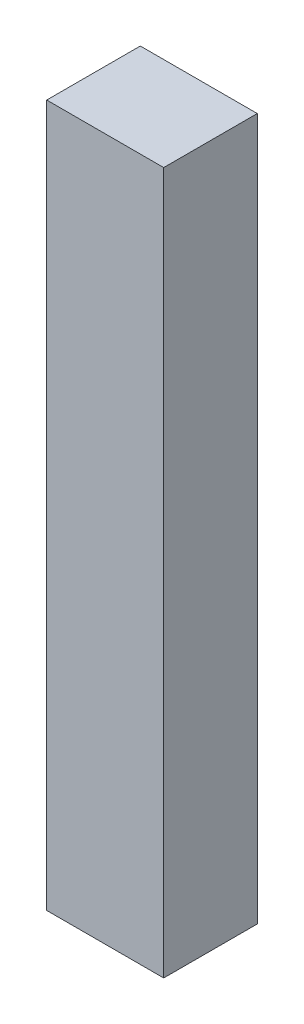
from build123d import *

# Parameters (mm, degrees)
SKETCH1_W           = 25
SKETCH1_H           = 20
BOSS_EXTRUDE1_DEPTH = 75


with BuildPart() as part:
    # Sketch1 → Boss-Extrude1 (new, symmetric)
    with BuildSketch(Plane(origin=(0, 0, 0), x_dir=(1, 0, 0), z_dir=(0, 1, 0))):
        Rectangle(SKETCH1_W, SKETCH1_H)
    extrude(amount=BOSS_EXTRUDE1_DEPTH, both=True)


solid = part.part
